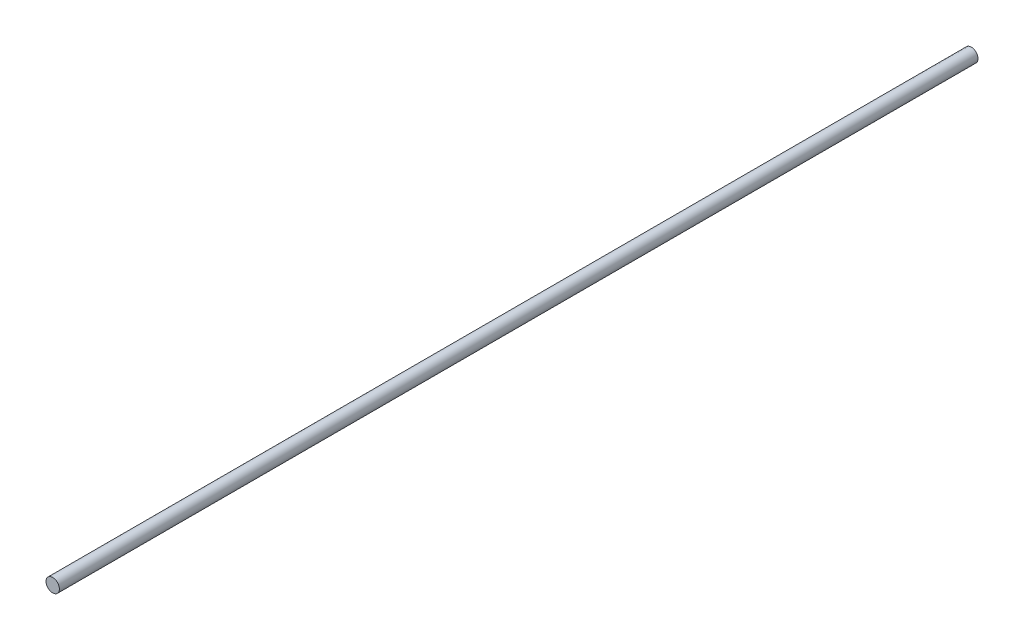
from build123d import *

# Parameters (mm, degrees)
SKETCH1_R           = 1.5
BOSS_EXTRUDE1_DEPTH = 206


with BuildPart() as part:
    # Sketch1 → Boss-Extrude1 (new body)
    with BuildSketch(Plane.XY):
        with Locations((2.024416597, -11.428905104)):
            Circle(SKETCH1_R)
    extrude(amount=BOSS_EXTRUDE1_DEPTH)


solid = part.part
